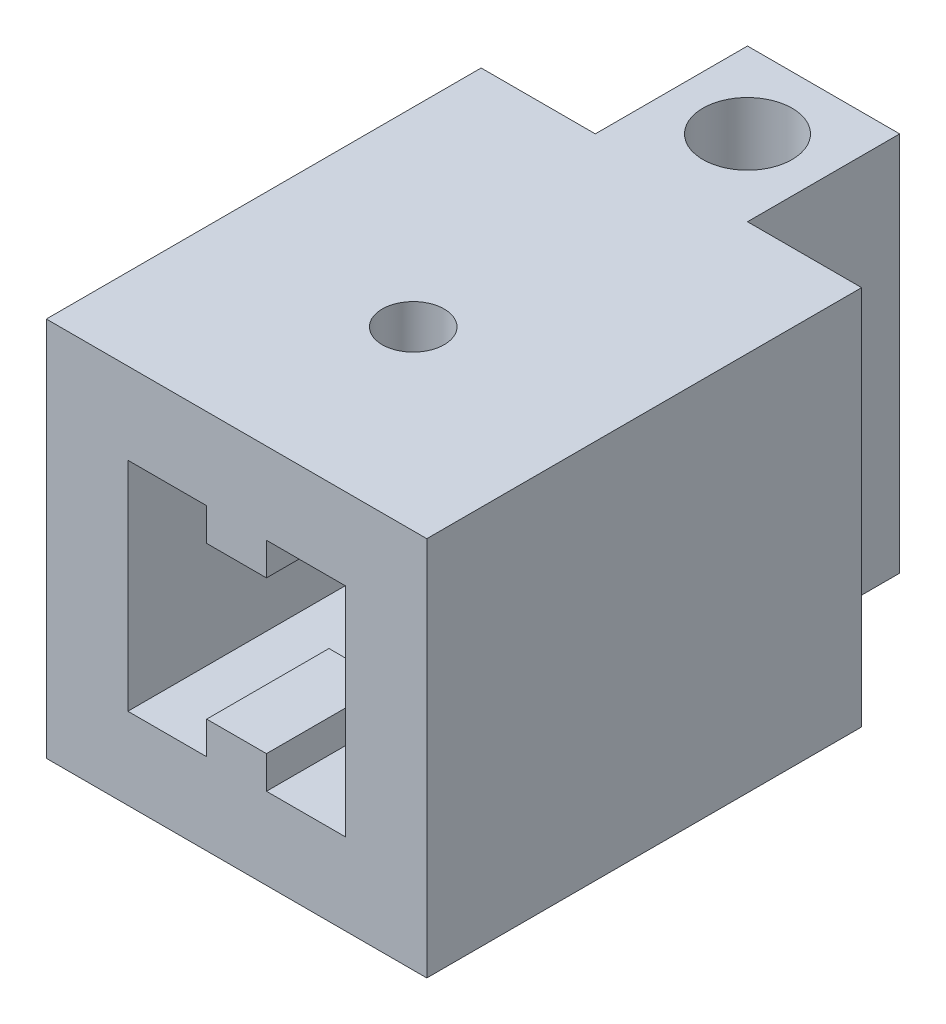
from build123d import *

# Parameters (mm, degrees)
SKETCH_1_W          = 35
SKETCH_1_H          = 35
EXTRUDE_1_DEPTH     = 40
SKETCH_2_W          = 5.5
SKETCH_2_H          = 5.5
SKETCH_2_H_2        = 4.25
SKETCH_2_W_2        = 4.25
SKETCH_2_W_3        = 3
CUT_EXTRUDE_4_DEPTH = 32.5
SKETCH_3_W          = 5.5
SKETCH_3_H          = 10
CUT_EXTRUDE_5_DEPTH = 3
SKETCH_4_W          = 5.5
SKETCH_4_H          = 10
CUT_EXTRUDE_6_DEPTH = 3
CUT_EXTRUDE_7_DEPTH = 56.957573214
SKETCH_6_W          = 14
SKETCH_6_H          = 35
EXTRUDE_2_DEPTH     = 14
CUT_EXTRUDE_8_DEPTH = 67.687705014
SKETCH_13_R         = 4.1
CUT_EXTRUDE_9_DEPTH = 67.687705014


with BuildPart() as part:
    # Эскиз1 → Бобышка-Вытянуть1 (new body)
    with BuildSketch(Plane.XY):
        Rectangle(SKETCH_1_W, SKETCH_1_H)
    extrude(amount=-EXTRUDE_1_DEPTH)

    # Эскиз2 → Вырез-Вытянуть4 (cut)
    with BuildSketch(Plane.XY):
        Rectangle(SKETCH_2_W, SKETCH_2_H)
        with Locations((0, 4.875)):
            Rectangle(SKETCH_2_W, SKETCH_2_H_2)
        with Locations((0, -4.875)):
            Rectangle(SKETCH_2_W, SKETCH_2_H_2)
        Polygon((10, -10), (10, -2.75), (7, -2.75), (2.75, -2.75), (2.75, -7), (2.75, -10), align=None)
        Polygon((10, 10), (2.75, 10), (2.75, 7), (2.75, 2.75), (7, 2.75), (10, 2.75), align=None)
        Polygon((-2.75, 10), (-10, 10), (-10, 2.75), (-7, 2.75), (-2.75, 2.75), (-2.75, 7), align=None)
        Polygon((-7, -2.75), (-10, -2.75), (-10, -10), (-2.75, -10), (-2.75, -7), (-2.75, -2.75), align=None)
        with Locations((-4.875, 0)):
            Rectangle(SKETCH_2_W_2, SKETCH_2_H)
        with Locations((-8.5, 0)):
            Rectangle(SKETCH_2_W_3, SKETCH_2_H)
        with Locations((4.875, 0)):
            Rectangle(SKETCH_2_W_2, SKETCH_2_H)
        with Locations((8.5, 0)):
            Rectangle(SKETCH_2_W_3, SKETCH_2_H)
    extrude(amount=-CUT_EXTRUDE_4_DEPTH, mode=Mode.SUBTRACT)

    # Эскиз3 → Вырез-Вытянуть5 (cut)
    with BuildSketch(Plane.XZ.offset(-7)):
        with Locations((0, -16.25)):
            Rectangle(SKETCH_3_W, SKETCH_3_H)
    extrude(amount=-CUT_EXTRUDE_5_DEPTH, mode=Mode.SUBTRACT)

    # Эскиз4 → Вырез-Вытянуть6 (cut)
    with BuildSketch(Plane(origin=(0, -7, 0), x_dir=(1, 0, 0), z_dir=(0, 1, 0))):
        with Locations((0, 16.25)):
            Rectangle(SKETCH_4_W, SKETCH_4_H)
    extrude(amount=-CUT_EXTRUDE_6_DEPTH, mode=Mode.SUBTRACT)

    # Эскиз5 → Вырез-Вытянуть7 (cut, through all)
    with BuildSketch(Plane(origin=(0, 17.5, 0), x_dir=(1, 0, 0), z_dir=(0, 1, 0))):
        with BuildLine():
            ThreePointArc((0, 19.1), (-2.85, 16.25), (0, 13.4))
            Line((0, 13.4), (0, 19.1))
        make_face()
        with BuildLine():
            Line((0, 19.1), (0, 13.4))
            ThreePointArc((0, 13.4), (2.015254326, 14.234745674), (2.85, 16.25))
            ThreePointArc((2.85, 16.25), (2.015254326, 18.265254326), (0, 19.1))
        make_face()
    extrude(amount=-CUT_EXTRUDE_7_DEPTH, mode=Mode.SUBTRACT)

    # Эскиз6 → Бобышка-Вытянуть2 (add)
    with BuildSketch(Plane(origin=(0, 0, -40), x_dir=(-1, 0, 0), z_dir=(0, 0, -1))):
        Rectangle(SKETCH_6_W, SKETCH_6_H)
    extrude(amount=EXTRUDE_2_DEPTH)

    # Эскиз7 → Вырез-Вытянуть8 (cut, through all)
    with BuildSketch(Plane(origin=(0, 17.5, 0), x_dir=(1, 0, 0), z_dir=(0, 1, 0))):
        with BuildLine():
            ThreePointArc((0, 51.03), (-4.03, 47), (0, 42.97))
            Line((0, 42.97), (0, 51.03))
        make_face()
        with BuildLine():
            Line((0, 51.03), (0, 42.97))
            ThreePointArc((0, 42.97), (2.849640328, 44.150359672), (4.03, 47))
            ThreePointArc((4.03, 47), (2.849640328, 49.849640328), (0, 51.03))
        make_face()
    extrude(amount=-CUT_EXTRUDE_8_DEPTH, mode=Mode.SUBTRACT)

    # Эскиз13 → Вырез-Вытянуть9 (cut, through all)
    with BuildSketch(Plane.XZ.offset(17.5)):
        with Locations(Location((0, -47, 0), (0, 0, 270))):
            Circle(SKETCH_13_R)
    extrude(amount=-CUT_EXTRUDE_9_DEPTH, mode=Mode.SUBTRACT)


solid = part.part
